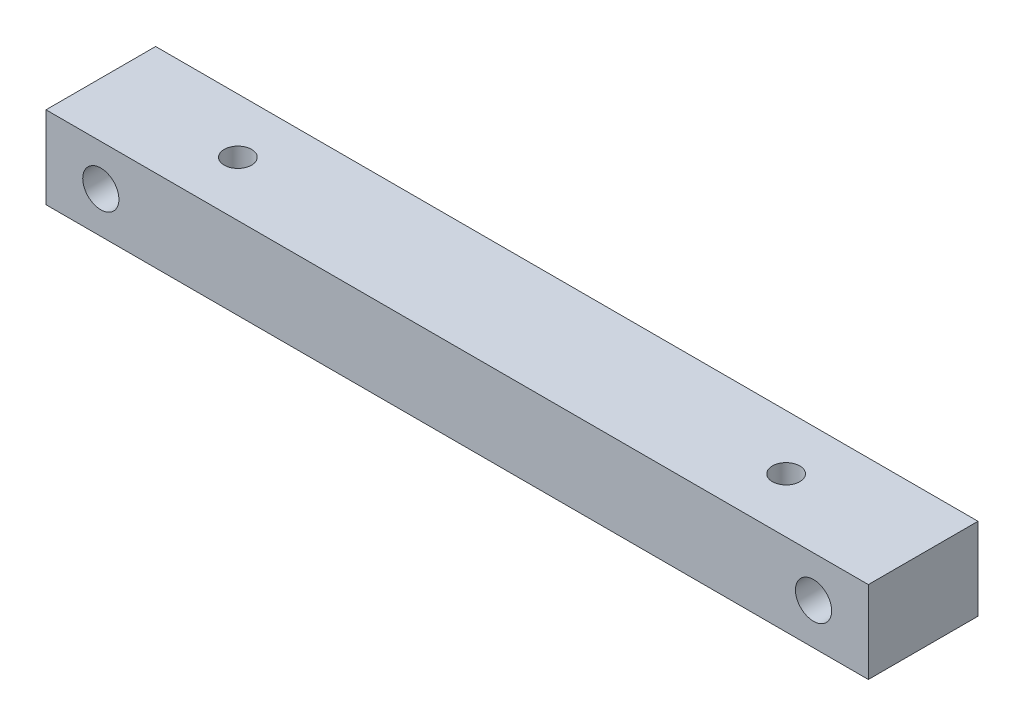
from build123d import *

# Parameters (mm, degrees)
SKETCH_1_W                     = 150
SKETCH_1_H                     = 15
EXTRUDE_1_DEPTH                = 20
HOLE_WIZARD_M6_1_D             = 5
HOLE_WIZARD_M6_1_2_D           = 6.6
HOLE_WIZARD_M6_1_2_CBORE_D     = 11
HOLE_WIZARD_M6_1_2_CBORE_DEPTH = 6


with BuildPart() as part:
    # 草圖1 → 伸長1 (new body)
    with BuildSketch(Plane.XY):
        Rectangle(SKETCH_1_W, SKETCH_1_H)
    extrude(amount=EXTRUDE_1_DEPTH)

    # Hole Wizard M6 _1 (through all)
    with Locations(Plane(origin=(0, 7.5, 0), x_dir=(-1, 0, 0), z_dir=(0, 1, 0))):
        with Locations((50, 10), (-50, 10)):
            Hole(HOLE_WIZARD_M6_1_D / 2)

    # Hole Wizard M6 _1 2 (through all)
    with Locations(Plane(origin=(0, 0, 0), x_dir=(-1, 0, 0), z_dir=(0, 0, -1))):
        with Locations((65, 0), (-65, 0)):
            CounterBoreHole(HOLE_WIZARD_M6_1_2_D / 2, HOLE_WIZARD_M6_1_2_CBORE_D / 2, HOLE_WIZARD_M6_1_2_CBORE_DEPTH)


solid = part.part
